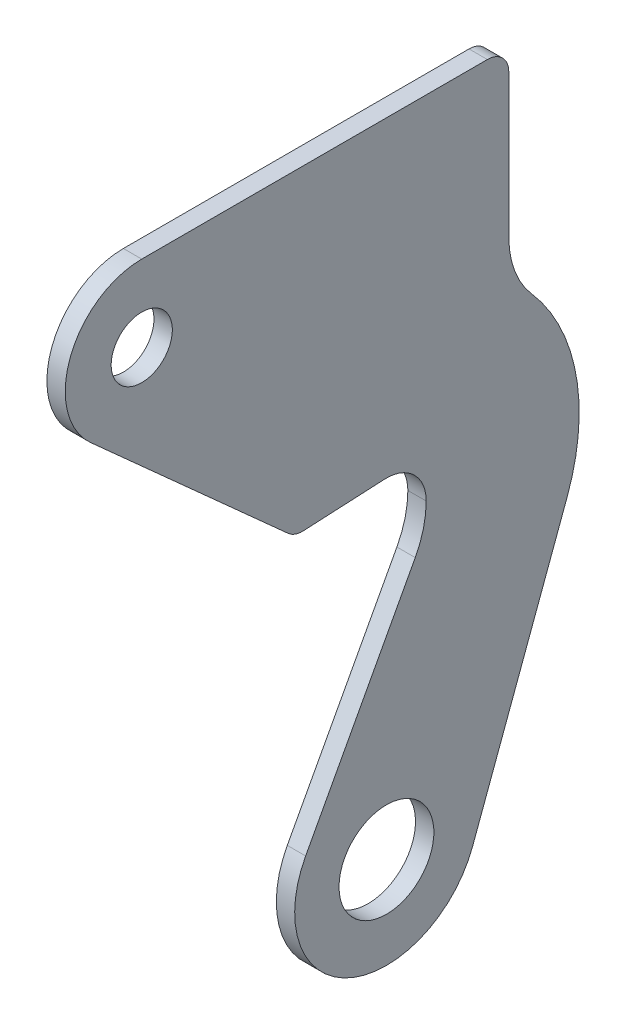
from build123d import *

# Parameters (mm, degrees)
SKETCH1_R           = 3.937
SKETCH1_R_2         = 2.54
BOSS_EXTRUDE1_DEPTH = 0.762
FILLET1_R           = 1.778
FILLET2_R           = 7.62


with BuildPart() as part:
    # Sketch1 → Boss-Extrude1 (new, symmetric)
    with BuildSketch(Plane(origin=(0, 0, 0), x_dir=(0, 0, -1), z_dir=(1, 0, 0))):
        with BuildLine():
            Line((-0.16671433, 27.427788703), (-7.62, 27.051))
            Line((-7.62, 27.051), (-24.562678082, 42.265364279))
            ThreePointArc((-24.562678082, 42.265364279), (-26.249752812, 49.261680344), (-20.32, 53.34))
            Line((-20.32, 53.34), (10.16, 53.34))
            Line((10.16, 53.34), (10.16, 36.49278302))
            ThreePointArc((10.16, 36.49278302), (15.447327881, 28.30660931), (15.005535214, 18.571410526))
            Line((15.005535214, 18.571410526), (7.145492959, -2.646947368))
            ThreePointArc((7.145492959, -2.646947368), (-3.137043416, -6.94430404), (-6.709547814, 3.611975654))
            Line((-6.709547814, 3.611975654), (2.391547814, 20.518024346))
            ThreePointArc((2.391547814, 20.518024346), (3.070881997, 22.267522395), (3.302, 24.13))
            ThreePointArc((3.302, 24.13), (2.275160794, 26.523083233), (-0.16671433, 27.427788703))
        make_face()
        with Locations(Location((0, 0, 0), (0, 0, 180))):
            Circle(SKETCH1_R, mode=Mode.SUBTRACT)
        with Locations(Location((-20.32, 46.99, 0), (0, 0, 180))):
            Circle(SKETCH1_R_2, mode=Mode.SUBTRACT)
    extrude(amount=BOSS_EXTRUDE1_DEPTH, both=True)

    # Fillet1
    fillet1_edges = [part.edges().sort_by_distance(p)[0] for p in [
        (0, 27.051, 7.62),
        (0, 53.34, -10.16),
    ]]
    fillet(fillet1_edges, radius=FILLET1_R)

    # Fillet2
    fillet2_edges = [part.edges().sort_by_distance(p)[0] for p in [
        (0, 36.49278302, -10.16),
    ]]
    fillet(fillet2_edges, radius=FILLET2_R)


solid = part.part
